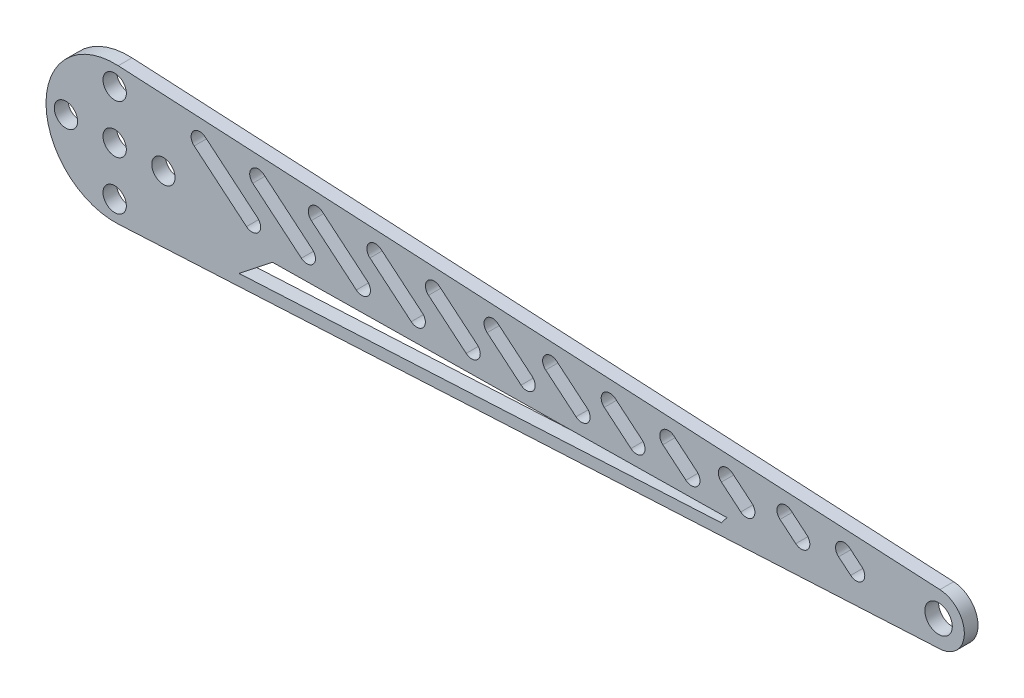
from build123d import *

# Parameters (mm, degrees)
SKETCH_2_R      = 1.7
SKETCH_2_R_2    = 2
EXTRUDE_1_DEPTH = 2


with BuildPart() as part:
    # 草图2 → 凸台-拉伸1 (new body)
    with BuildSketch(Plane.XY):
        with BuildLine():
            Line((120.1953125, 3.744910283), (0.520833333, 9.986427421))
            ThreePointArc((0.520833333, 9.986427421), (-10, 0), (0.520833333, -9.986427421))
            Line((0.520833333, -9.986427421), (120.1953125, -3.744910283))
            ThreePointArc((120.1953125, -3.744910283), (123.75, 0), (120.1953125, 3.744910283))
        make_face()
        with Locations((0, 7.1)):
            Circle(SKETCH_2_R, mode=Mode.SUBTRACT)
        Circle(SKETCH_2_R, mode=Mode.SUBTRACT)
        with Locations((7.1, 0)):
            Circle(SKETCH_2_R, mode=Mode.SUBTRACT)
        with Locations((-7.1, 0)):
            Circle(SKETCH_2_R, mode=Mode.SUBTRACT)
        with Locations((0, -7.1)):
            Circle(SKETCH_2_R, mode=Mode.SUBTRACT)
        with Locations((120, 0)):
            Circle(SKETCH_2_R_2, mode=Mode.SUBTRACT)
        with BuildLine():
            Line((19.199560495, -0.96370295), (11.58500645, 5.399602936))
            ThreePointArc((11.58500645, 5.399602936), (11.426647663, 7.168650049), (13.195694776, 7.327008836))
            Line((13.195694776, 7.327008836), (20.810248822, 0.96370295))
            ThreePointArc((20.810248822, 0.96370295), (20.968607609, -0.805344163), (19.199560495, -0.96370295))
        make_face(mode=Mode.SUBTRACT)
        with BuildLine():
            Line((27.198443723, -0.959170233), (20.116072333, 4.959402974))
            ThreePointArc((20.116072333, 4.959402974), (19.958458377, 6.720129483), (21.719184886, 6.87774344))
            Line((21.719184886, 6.87774344), (28.801556277, 0.959170233))
            ThreePointArc((28.801556277, 0.959170233), (28.959170233, -0.801556277), (27.198443723, -0.959170233))
        make_face(mode=Mode.SUBTRACT)
        with BuildLine():
            Line((35.198443723, -0.959170233), (28.64858146, 4.51439747))
            ThreePointArc((28.64858146, 4.51439747), (28.490967504, 6.275123979), (30.251694013, 6.432737935))
            Line((30.251694013, 6.432737935), (36.801556277, 0.959170233))
            ThreePointArc((36.801556277, 0.959170233), (36.959170233, -0.801556277), (35.198443723, -0.959170233))
        make_face(mode=Mode.SUBTRACT)
        with BuildLine():
            Line((43.198443723, -0.959170233), (37.181090587, 4.069391965))
            ThreePointArc((37.181090587, 4.069391965), (37.023476631, 5.830118475), (38.784203141, 5.987732431))
            Line((38.784203141, 5.987732431), (44.801556277, 0.959170233))
            ThreePointArc((44.801556277, 0.959170233), (44.959170233, -0.801556277), (43.198443723, -0.959170233))
        make_face(mode=Mode.SUBTRACT)
        with BuildLine():
            Line((51.198443723, -0.959170233), (45.713599714, 3.624386461))
            ThreePointArc((45.713599714, 3.624386461), (45.555985758, 5.38511297), (47.316712268, 5.542726927))
            Line((47.316712268, 5.542726927), (52.801556277, 0.959170233))
            ThreePointArc((52.801556277, 0.959170233), (52.959170233, -0.801556277), (51.198443723, -0.959170233))
        make_face(mode=Mode.SUBTRACT)
        with BuildLine():
            Line((59.198443723, -0.959170233), (54.246108842, 3.179380957))
            ThreePointArc((54.246108842, 3.179380957), (54.088494885, 4.940107466), (55.849221395, 5.097721422))
            Line((55.849221395, 5.097721422), (60.801556277, 0.959170233))
            ThreePointArc((60.801556277, 0.959170233), (60.959170233, -0.801556277), (59.198443723, -0.959170233))
        make_face(mode=Mode.SUBTRACT)
        with BuildLine():
            Line((67.198443723, -0.959170233), (62.778617969, 2.734375453))
            ThreePointArc((62.778617969, 2.734375453), (62.621004012, 4.495101962), (64.381730522, 4.652715918))
            Line((64.381730522, 4.652715918), (68.801556277, 0.959170233))
            ThreePointArc((68.801556277, 0.959170233), (68.959170233, -0.801556277), (67.198443723, -0.959170233))
        make_face(mode=Mode.SUBTRACT)
        with BuildLine():
            Line((75.198443723, -0.959170233), (71.311127096, 2.289369948))
            ThreePointArc((71.311127096, 2.289369948), (71.153513139, 4.050096458), (72.914239649, 4.207710414))
            Line((72.914239649, 4.207710414), (76.801556277, 0.959170233))
            ThreePointArc((76.801556277, 0.959170233), (76.959170233, -0.801556277), (75.198443723, -0.959170233))
        make_face(mode=Mode.SUBTRACT)
        with BuildLine():
            Line((83.198443723, -0.959170233), (79.843636223, 1.844364444))
            ThreePointArc((79.843636223, 1.844364444), (79.686022267, 3.605090953), (81.446748776, 3.76270491))
            Line((81.446748776, 3.76270491), (84.801556277, 0.959170233))
            ThreePointArc((84.801556277, 0.959170233), (84.959170233, -0.801556277), (83.198443723, -0.959170233))
        make_face(mode=Mode.SUBTRACT)
        with BuildLine():
            Line((91.198443723, -0.959170233), (88.37614535, 1.39935894))
            ThreePointArc((88.37614535, 1.39935894), (88.218531394, 3.160085449), (89.979257903, 3.317699405))
            Line((89.979257903, 3.317699405), (92.801556277, 0.959170233))
            ThreePointArc((92.801556277, 0.959170233), (92.959170233, -0.801556277), (91.198443723, -0.959170233))
        make_face(mode=Mode.SUBTRACT)
        with BuildLine():
            Line((99.198443723, -0.959170233), (96.908654477, 0.954353436))
            ThreePointArc((96.908654477, 0.954353436), (96.751040521, 2.715079945), (98.51176703, 2.872693901))
            Line((98.51176703, 2.872693901), (100.801556277, 0.959170233))
            ThreePointArc((100.801556277, 0.959170233), (100.959170233, -0.801556277), (99.198443723, -0.959170233))
        make_face(mode=Mode.SUBTRACT)
        with BuildLine():
            Line((107.198443723, -0.959170233), (105.441163604, 0.509347931))
            ThreePointArc((105.441163604, 0.509347931), (105.283549648, 2.270074441), (107.044276157, 2.427688397))
            Line((107.044276157, 2.427688397), (108.801556277, 0.959170233))
            ThreePointArc((108.801556277, 0.959170233), (108.959170233, -0.801556277), (107.198443723, -0.959170233))
        make_face(mode=Mode.SUBTRACT)
        Polygon((22.985742471, -3.574018318), (89.177701626, -2.685452731), (88.37614535, -3.744910283), (18.132146509, -7.408424222), align=None, mode=Mode.SUBTRACT)
    extrude(amount=EXTRUDE_1_DEPTH)


solid = part.part
